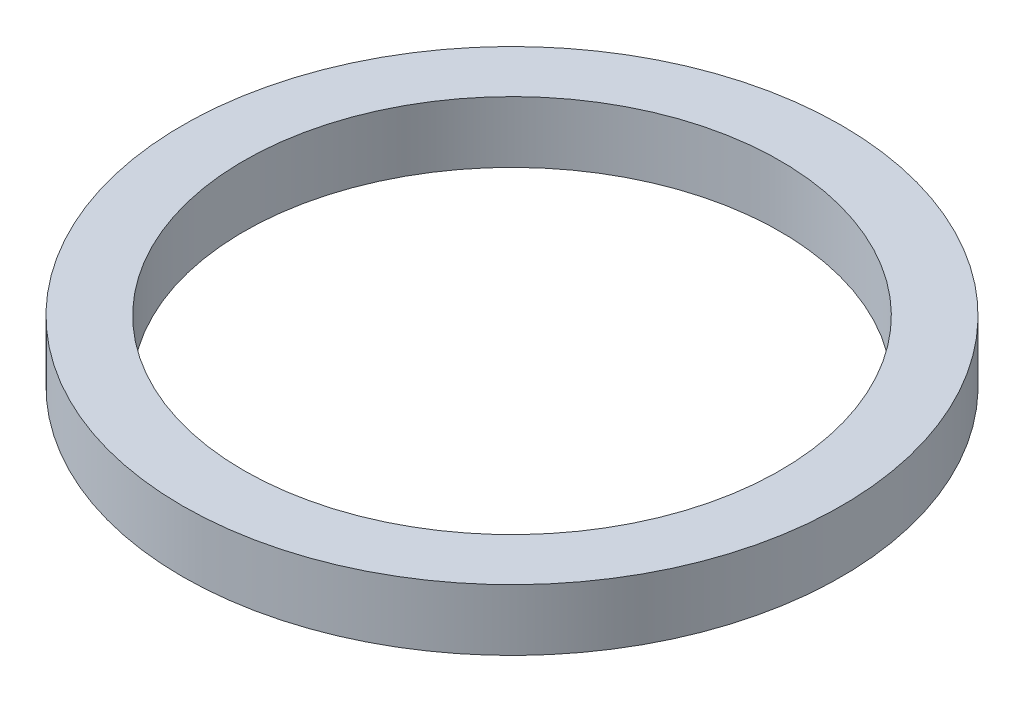
from build123d import *

# Parameters (mm, degrees)
SKETCH_1_R      = 43
SKETCH_1_R_2    = 35
EXTRUDE_1_DEPTH = 8


with BuildPart() as part:
    # 草图1 → 凸台-拉伸1 (new body)
    with BuildSketch(Plane(origin=(0, 0, 0), x_dir=(1, 0, 0), z_dir=(0, 1, 0))):
        with Locations(Location((0, 0, 0), (0, 0, 270))):
            Circle(SKETCH_1_R)
        with Locations(Location((0, 0, 0), (0, 0, 270))):
            Circle(SKETCH_1_R_2, mode=Mode.SUBTRACT)
    extrude(amount=EXTRUDE_1_DEPTH)


solid = part.part
